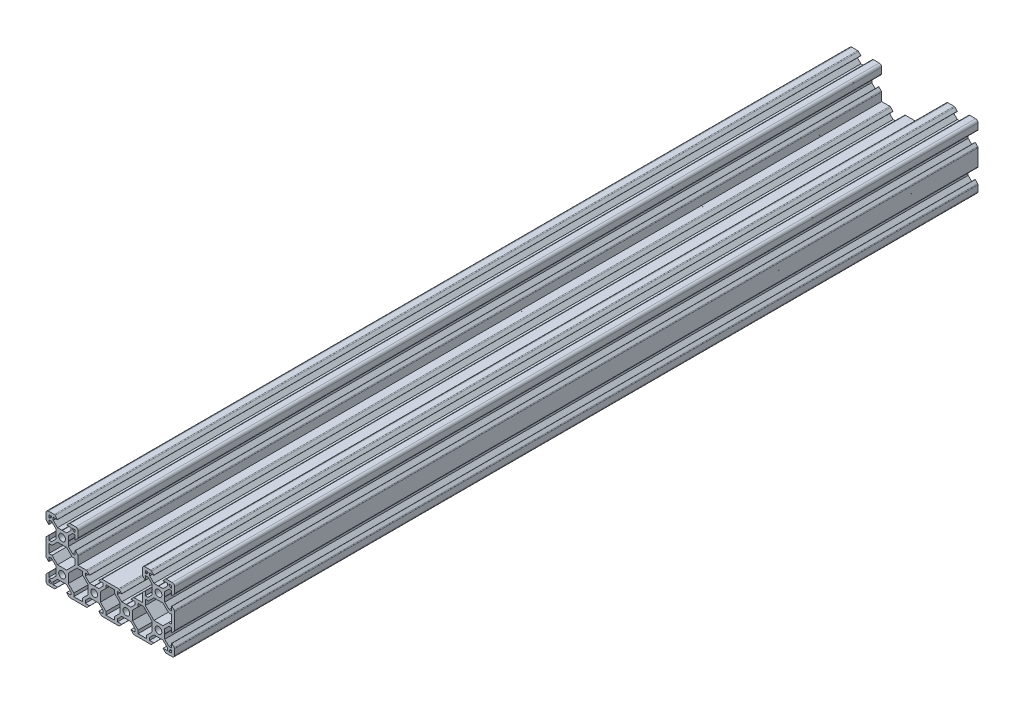
from build123d import *

# Parameters (mm, degrees)
SKETCH3_R           = 2.1
BOSS_EXTRUDE3_DEPTH = 500


with BuildPart() as part:
    # Sketch3 → Boss-Extrude3 (new body)
    with BuildSketch(Plane.XY):
        with BuildLine():
            Line((-8.2, 2.882517024), (-8.2, 5.495853945))
            Line((-8.2, 5.495853945), (-6.56, 5.495853945))
            Line((-6.56, 5.495853945), (-3.9, 2.836663079))
            Line((-3.9, 2.836663079), (-3.9, 0.09834827))
            Line((-3.9, 0.09834827), (-3.799157405, 0.00963488))
            Line((-3.799157405, 0.00963488), (-3.9, -0.103336921))
            Line((-3.9, -0.103336921), (-3.9, -2.84165173))
            Line((-3.9, -2.84165173), (-6.56, -5.496196366))
            Line((-6.56, -5.496196366), (-8.2, -5.496196366))
            Line((-8.2, -5.496196366), (-8.2, -2.882859445))
            Line((-8.2, -2.882859445), (-8.31, -2.882859445))
            Line((-8.31, -2.882859445), (-9.765685425, -4.33854487))
            ThreePointArc((-9.765685425, -4.33854487), (-9.939103626, -4.598083549), (-10, -4.904230295))
            Line((-10, -4.904230295), (-10, -15.093617801))
            ThreePointArc((-10, -15.093617801), (-9.939103626, -15.399764547), (-9.765685425, -15.659303226))
            Line((-9.765685425, -15.659303226), (-8.31, -17.114988651))
            Line((-8.31, -17.114988651), (-8.2, -17.114988651))
            Line((-8.2, -17.114988651), (-8.2, -14.50165173))
            Line((-8.2, -14.50165173), (-6.56, -14.50165173))
            Line((-6.56, -14.50165173), (-3.9, -17.168325571))
            Line((-3.9, -17.168325571), (-3.9, -19.906640381))
            Line((-3.9, -19.906640381), (-3.805222007, -20.001418373))
            Line((-3.805222007, -20.001418373), (-3.9, -20.096196366))
            Line((-3.9, -20.096196366), (-3.9, -22.834511176))
            Line((-3.9, -22.834511176), (-6.56, -25.493702041))
            Line((-6.56, -25.493702041), (-8.2, -25.493702041))
            Line((-8.2, -25.493702041), (-8.2, -22.88036512))
            Line((-8.2, -22.88036512), (-8.31, -22.88036512))
            Line((-8.31, -22.88036512), (-9.768614357, -24.338979477))
            ThreePointArc((-9.768614357, -24.338979477), (-9.939864831, -24.595273923), (-10, -24.897593834))
            Line((-10, -24.897593834), (-10, -28.49036512))
            ThreePointArc((-10, -28.49036512), (-9.560660172, -29.551025292), (-8.5, -29.99036512))
            Line((-8.5, -29.99036512), (-4.907228714, -29.99036512))
            ThreePointArc((-4.907228714, -29.99036512), (-4.597037815, -29.933069776), (-4.333990827, -29.758979477))
            Line((-4.333990827, -29.758979477), (-2.87537647, -28.30036512))
            Line((-2.87537647, -28.30036512), (-2.87537647, -28.19036512))
            Line((-2.87537647, -28.19036512), (-5.48871339, -28.19036512))
            Line((-5.48871339, -28.19036512), (-5.48871339, -26.551685287))
            Line((-5.48871339, -26.551685287), (-2.829078524, -23.892859445))
            Line((-2.829078524, -23.892859445), (-0.08871339, -23.892859445))
            Line((-0.08871339, -23.892859445), (0, -23.792859445))
            Line((0, -23.792859445), (0.08871339, -23.892859445))
            Line((0.08871339, -23.892859445), (2.829078524, -23.892859445))
            Line((2.829078524, -23.892859445), (5.503336921, -26.551280874))
            Line((5.503336921, -26.551280874), (5.503336921, -28.19036512))
            Line((5.503336921, -28.19036512), (2.89, -28.19036512))
            Line((2.89, -28.19036512), (2.89, -28.30036512))
            Line((2.89, -28.30036512), (4.345685425, -29.756050545))
            ThreePointArc((4.345685425, -29.756050545), (4.605224104, -29.929468746), (4.91137085, -29.99036512))
            Line((4.91137085, -29.99036512), (15.08862915, -29.99036512))
            ThreePointArc((15.08862915, -29.99036512), (15.394775896, -29.929468746), (15.654314575, -29.756050545))
            Line((15.654314575, -29.756050545), (17.11, -28.30036512))
            Line((17.11, -28.30036512), (17.11, -28.19036512))
            Line((17.11, -28.19036512), (14.496663079, -28.19036512))
            Line((14.496663079, -28.19036512), (14.496663079, -26.552454909))
            Line((14.496663079, -26.552454909), (17.170477537, -23.892859445))
            Line((17.170477537, -23.892859445), (19.910477537, -23.892859445))
            Line((19.910477537, -23.892859445), (20.010927049, -23.792944111))
            Line((20.010927049, -23.792944111), (20.110842384, -23.892859445))
            Line((20.110842384, -23.892859445), (22.849157193, -23.892859445))
            Line((22.849157193, -23.892859445), (25.51587163, -26.559573883))
            Line((25.51587163, -26.559573883), (25.48871339, -28.19036512))
            Line((25.48871339, -28.19036512), (22.87537647, -28.19036512))
            Line((22.87537647, -28.19036512), (22.87537647, -28.30036512))
            Line((22.87537647, -28.30036512), (24.331061895, -29.756050545))
            ThreePointArc((24.331061895, -29.756050545), (24.590600574, -29.929468746), (24.89674732, -29.99036512))
            Line((24.89674732, -29.99036512), (35.10325268, -29.99036512))
            ThreePointArc((35.10325268, -29.99036512), (35.409399426, -29.929468746), (35.668938105, -29.756050545))
            Line((35.668938105, -29.756050545), (37.12462353, -28.30036512))
            Line((37.12462353, -28.30036512), (37.12462353, -28.19036512))
            Line((37.12462353, -28.19036512), (34.51128661, -28.19036512))
            Line((34.51128661, -28.19036512), (34.48412837, -26.559573883))
            Line((34.48412837, -26.559573883), (37.150842807, -23.892859445))
            Line((37.150842807, -23.892859445), (39.889157616, -23.892859445))
            Line((39.889157616, -23.892859445), (39.989072951, -23.792944111))
            Line((39.989072951, -23.792944111), (40.089522463, -23.892859445))
            Line((40.089522463, -23.892859445), (42.829522463, -23.892859445))
            Line((42.829522463, -23.892859445), (45.503336921, -26.552454909))
            Line((45.503336921, -26.552454909), (45.503336921, -28.19036512))
            Line((45.503336921, -28.19036512), (42.89, -28.19036512))
            Line((42.89, -28.19036512), (42.89, -28.30036512))
            Line((42.89, -28.30036512), (44.345685425, -29.756050545))
            ThreePointArc((44.345685425, -29.756050545), (44.605224104, -29.929468746), (44.91137085, -29.99036512))
            Line((44.91137085, -29.99036512), (55.08862915, -29.99036512))
            ThreePointArc((55.08862915, -29.99036512), (55.394775896, -29.929468746), (55.654314575, -29.756050545))
            Line((55.654314575, -29.756050545), (57.11, -28.30036512))
            Line((57.11, -28.30036512), (57.11, -28.19036512))
            Line((57.11, -28.19036512), (54.496663079, -28.19036512))
            Line((54.496663079, -28.19036512), (54.496663079, -26.551280874))
            Line((54.496663079, -26.551280874), (57.170921476, -23.892859445))
            Line((57.170921476, -23.892859445), (59.91128661, -23.892859445))
            Line((59.91128661, -23.892859445), (60, -23.792859445))
            Line((60, -23.792859445), (60.08871339, -23.892859445))
            Line((60.08871339, -23.892859445), (62.829078524, -23.892859445))
            Line((62.829078524, -23.892859445), (65.48871339, -26.551685287))
            Line((65.48871339, -26.551685287), (65.48871339, -28.19036512))
            Line((65.48871339, -28.19036512), (62.87537647, -28.19036512))
            Line((62.87537647, -28.19036512), (62.87537647, -28.30036512))
            Line((62.87537647, -28.30036512), (64.333990827, -29.758979477))
            ThreePointArc((64.333990827, -29.758979477), (64.597037815, -29.933069776), (64.907228714, -29.99036512))
            Line((64.907228714, -29.99036512), (68.5, -29.99036512))
            ThreePointArc((68.5, -29.99036512), (69.560660172, -29.551025292), (70, -28.49036512))
            Line((70, -28.49036512), (70, -24.897593834))
            ThreePointArc((70, -24.897593834), (69.939864831, -24.595273923), (69.768614357, -24.338979477))
            Line((69.768614357, -24.338979477), (68.31, -22.88036512))
            Line((68.31, -22.88036512), (68.2, -22.88036512))
            Line((68.2, -22.88036512), (68.2, -25.493702041))
            Line((68.2, -25.493702041), (66.56, -25.493702041))
            Line((66.56, -25.493702041), (63.9, -22.834511176))
            Line((63.9, -22.834511176), (63.9, -20.096196366))
            Line((63.9, -20.096196366), (63.805222007, -20.001418373))
            Line((63.805222007, -20.001418373), (63.9, -19.906640381))
            Line((63.9, -19.906640381), (63.9, -17.168325571))
            Line((63.9, -17.168325571), (66.56, -14.50165173))
            Line((66.56, -14.50165173), (68.2, -14.50165173))
            Line((68.2, -14.50165173), (68.2, -17.114988651))
            Line((68.2, -17.114988651), (68.31, -17.114988651))
            Line((68.31, -17.114988651), (69.765685425, -15.659303226))
            ThreePointArc((69.765685425, -15.659303226), (69.939103626, -15.399764547), (70, -15.093617801))
            Line((70, -15.093617801), (70, -4.904230295))
            ThreePointArc((70, -4.904230295), (69.939103626, -4.598083549), (69.765685425, -4.33854487))
            Line((69.765685425, -4.33854487), (68.31, -2.882859445))
            Line((68.31, -2.882859445), (68.2, -2.882859445))
            Line((68.2, -2.882859445), (68.2, -5.496196366))
            Line((68.2, -5.496196366), (66.56, -5.496196366))
            Line((66.56, -5.496196366), (63.9, -2.84165173))
            Line((63.9, -2.84165173), (63.9, -0.103336921))
            Line((63.9, -0.103336921), (63.799157405, 0.00963488))
            Line((63.799157405, 0.00963488), (63.9, 0.09834827))
            Line((63.9, 0.09834827), (63.9, 2.836663079))
            Line((63.9, 2.836663079), (66.56, 5.495853945))
            Line((66.56, 5.495853945), (68.2, 5.495853945))
            Line((68.2, 5.495853945), (68.2, 2.882517024))
            Line((68.2, 2.882517024), (68.31, 2.882517024))
            Line((68.31, 2.882517024), (69.768614357, 4.341131381))
            ThreePointArc((69.768614357, 4.341131381), (69.939864831, 4.597425827), (70, 4.899745738))
            Line((70, 4.899745738), (70, 8.505591811))
            ThreePointArc((70, 8.505591811), (69.559475984, 9.569110864), (68.495956932, 10.00963488))
            Line((68.495956932, 10.00963488), (64.899916949, 10.00963488))
            ThreePointArc((64.899916949, 10.00963488), (64.597597038, 9.949499711), (64.341302592, 9.778249237))
            Line((64.341302592, 9.778249237), (62.882688235, 8.31963488))
            Line((62.882688235, 8.31963488), (62.882688235, 8.20798315))
            Line((62.882688235, 8.20798315), (65.496025155, 8.20798315))
            Line((65.496025155, 8.20798315), (65.496025155, 6.565966397))
            Line((65.496025155, 6.565966397), (62.835002123, 3.907140555))
            Line((62.835002123, 3.907140555), (60.106673841, 3.907140555))
            Line((60.106673841, 3.907140555), (60, 3.807140555))
            Line((60, 3.807140555), (59.893326159, 3.907140555))
            Line((59.893326159, 3.907140555), (57.164997877, 3.907140555))
            Line((57.164997877, 3.907140555), (54.503974845, 6.565966397))
            Line((54.503974845, 6.565966397), (54.503974845, 8.20798315))
            Line((54.503974845, 8.20798315), (57.117311765, 8.20798315))
            Line((57.117311765, 8.20798315), (57.117311765, 8.31963488))
            Line((57.117311765, 8.31963488), (55.658697408, 9.778249237))
            ThreePointArc((55.658697408, 9.778249237), (55.402402962, 9.949499711), (55.100083051, 10.00963488))
            Line((55.100083051, 10.00963488), (51.504043068, 10.00963488))
            ThreePointArc((51.504043068, 10.00963488), (50.440524016, 9.569110864), (50, 8.505591811))
            Line((50, 8.505591811), (50, 4.899745738))
            ThreePointArc((50, 4.899745738), (50.060135169, 4.597425827), (50.231385643, 4.341131381))
            Line((50.231385643, 4.341131381), (51.69, 2.882517024))
            Line((51.69, 2.882517024), (51.8, 2.882517024))
            Line((51.8, 2.882517024), (51.8, 5.495853945))
            Line((51.8, 5.495853945), (53.44, 5.495853945))
            Line((53.44, 5.495853945), (56.1, 2.836663079))
            Line((56.1, 2.836663079), (56.1, 0.09834827))
            Line((56.1, 0.09834827), (56.200842595, 0.00963488))
            Line((56.200842595, 0.00963488), (56.1, -0.103336921))
            Line((56.1, -0.103336921), (56.1, -2.84165173))
            Line((56.1, -2.84165173), (53.44, -5.496196366))
            Line((53.44, -5.496196366), (51.8, -5.496196366))
            Line((51.8, -5.496196366), (51.8, -2.882859445))
            Line((51.8, -2.882859445), (51.69, -2.882859445))
            Line((51.69, -2.882859445), (50.234314575, -4.33854487))
            ThreePointArc((50.234314575, -4.33854487), (50.060896374, -4.598083549), (50, -4.904230295))
            Line((50, -4.904230295), (50, -9.99036512))
            Line((50, -9.99036512), (44.898067602, -9.99036512))
            ThreePointArc((44.898067602, -9.99036512), (44.591343398, -10.053565048), (44.332382177, -10.229670286))
            Line((44.332382177, -10.229670286), (42.876696752, -11.685355711))
            Line((42.876696752, -11.685355711), (42.876696752, -11.789524465))
            Line((42.876696752, -11.789524465), (45.490033672, -11.789524465))
            Line((45.490033672, -11.789524465), (45.490033672, -13.429929001))
            Line((45.490033672, -13.429929001), (42.830438209, -16.089524465))
            Line((42.830438209, -16.089524465), (40.090438209, -16.089524465))
            Line((40.090438209, -16.089524465), (39.990255786, -16.189706888))
            Line((39.990255786, -16.189706888), (39.890073362, -16.089524465))
            Line((39.890073362, -16.089524465), (37.151758553, -16.089524465))
            Line((37.151758553, -16.089524465), (34.492163089, -13.429929001))
            Line((34.492163089, -13.429929001), (34.497983423, -11.79036512))
            Line((34.497983423, -11.79036512), (37.111320344, -11.79036512))
            Line((37.111320344, -11.79036512), (37.111320344, -11.68036512))
            Line((37.111320344, -11.68036512), (35.655634919, -10.224679695))
            ThreePointArc((35.655634919, -10.224679695), (35.39609624, -10.051261494), (35.089949494, -9.99036512))
            Line((35.089949494, -9.99036512), (24.910050506, -9.99036512))
            ThreePointArc((24.910050506, -9.99036512), (24.60390376, -10.051261494), (24.344365081, -10.224679695))
            Line((24.344365081, -10.224679695), (22.888679656, -11.68036512))
            Line((22.888679656, -11.68036512), (22.888679656, -11.79036512))
            Line((22.888679656, -11.79036512), (25.502016577, -11.79036512))
            Line((25.502016577, -11.79036512), (25.507836911, -13.429929001))
            Line((25.507836911, -13.429929001), (22.848241447, -16.089524465))
            Line((22.848241447, -16.089524465), (20.109926638, -16.089524465))
            Line((20.109926638, -16.089524465), (20.009744214, -16.189706888))
            Line((20.009744214, -16.189706888), (19.909561791, -16.089524465))
            Line((19.909561791, -16.089524465), (17.169561791, -16.089524465))
            Line((17.169561791, -16.089524465), (14.509966328, -13.429929001))
            Line((14.509966328, -13.429929001), (14.509966328, -11.789524465))
            Line((14.509966328, -11.789524465), (17.123303248, -11.789524465))
            Line((17.123303248, -11.789524465), (17.123303248, -11.685355711))
            Line((17.123303248, -11.685355711), (15.667617823, -10.229670286))
            ThreePointArc((15.667617823, -10.229670286), (15.408656602, -10.053565048), (15.101932398, -9.99036512))
            Line((15.101932398, -9.99036512), (10, -9.99036512))
            Line((10, -9.99036512), (10, -4.904230295))
            ThreePointArc((10, -4.904230295), (9.939103626, -4.598083549), (9.765685425, -4.33854487))
            Line((9.765685425, -4.33854487), (8.31, -2.882859445))
            Line((8.31, -2.882859445), (8.2, -2.882859445))
            Line((8.2, -2.882859445), (8.2, -5.496196366))
            Line((8.2, -5.496196366), (6.56, -5.496196366))
            Line((6.56, -5.496196366), (3.9, -2.84165173))
            Line((3.9, -2.84165173), (3.9, -0.103336921))
            Line((3.9, -0.103336921), (3.799157405, 0.00963488))
            Line((3.799157405, 0.00963488), (3.9, 0.09834827))
            Line((3.9, 0.09834827), (3.9, 2.836663079))
            Line((3.9, 2.836663079), (6.56, 5.495853945))
            Line((6.56, 5.495853945), (8.2, 5.495853945))
            Line((8.2, 5.495853945), (8.2, 2.882517024))
            Line((8.2, 2.882517024), (8.31, 2.882517024))
            Line((8.31, 2.882517024), (9.768614357, 4.341131381))
            ThreePointArc((9.768614357, 4.341131381), (9.939864831, 4.597425827), (10, 4.899745738))
            Line((10, 4.899745738), (10, 8.505591811))
            ThreePointArc((10, 8.505591811), (9.559475984, 9.569110864), (8.495956932, 10.00963488))
            Line((8.495956932, 10.00963488), (4.899916949, 10.00963488))
            ThreePointArc((4.899916949, 10.00963488), (4.597597038, 9.949499711), (4.341302592, 9.778249237))
            Line((4.341302592, 9.778249237), (2.882688235, 8.31963488))
            Line((2.882688235, 8.31963488), (2.882688235, 8.20798315))
            Line((2.882688235, 8.20798315), (5.496025155, 8.20798315))
            Line((5.496025155, 8.20798315), (5.496025155, 6.565966397))
            Line((5.496025155, 6.565966397), (2.835002123, 3.907140555))
            Line((2.835002123, 3.907140555), (0.106673841, 3.907140555))
            Line((0.106673841, 3.907140555), (0, 3.807140555))
            Line((0, 3.807140555), (-0.106673841, 3.907140555))
            Line((-0.106673841, 3.907140555), (-2.835002123, 3.907140555))
            Line((-2.835002123, 3.907140555), (-5.496025155, 6.565966397))
            Line((-5.496025155, 6.565966397), (-5.496025155, 8.20798315))
            Line((-5.496025155, 8.20798315), (-2.882688235, 8.20798315))
            Line((-2.882688235, 8.20798315), (-2.882688235, 8.31963488))
            Line((-2.882688235, 8.31963488), (-4.341302592, 9.778249237))
            ThreePointArc((-4.341302592, 9.778249237), (-4.597597038, 9.949499711), (-4.899916949, 10.00963488))
            Line((-4.899916949, 10.00963488), (-8.495956932, 10.00963488))
            ThreePointArc((-8.495956932, 10.00963488), (-9.559475984, 9.569110864), (-10, 8.505591811))
            Line((-10, 8.505591811), (-10, 4.899745738))
            ThreePointArc((-10, 4.899745738), (-9.939864831, 4.597425827), (-9.768614357, 4.341131381))
            Line((-9.768614357, 4.341131381), (-8.31, 2.882517024))
            Line((-8.31, 2.882517024), (-8.2, 2.882517024))
        make_face()
        with Locations((0, 0.00963488)):
            Circle(SKETCH3_R, mode=Mode.SUBTRACT)
        with Locations((0, -19.99036512)):
            Circle(SKETCH3_R, mode=Mode.SUBTRACT)
        with Locations((20, -19.99036512)):
            Circle(SKETCH3_R, mode=Mode.SUBTRACT)
        with Locations(Location((40, -19.99036512, 0), (0, 0, 180))):
            Circle(SKETCH3_R, mode=Mode.SUBTRACT)
        with Locations(Location((60, -19.99036512, 0), (0, 0, 180))):
            Circle(SKETCH3_R, mode=Mode.SUBTRACT)
        with Locations(Location((60, 0.00963488, 0), (0, 0, 180))):
            Circle(SKETCH3_R, mode=Mode.SUBTRACT)
        Polygon((-6.57, 8.20798315), (-6.57, 7.66798315), (-7.66, 6.57798315), (-8.2, 6.57798315), (-8.2, 8.20798315), align=None, mode=Mode.SUBTRACT)
        Polygon((-8.2, -7.297745508), (-6.238124911, -7.297745508), (-2.835002123, -3.901602147), (0, -3.901602147), (2.835002123, -3.901602147), (6.238124911, -7.297745508), (8.2, -7.297745508), (8.2, -10.729522525), (2.84, -16.089522525), (0, -16.089522525), (-2.840365134, -16.089522525), (-6.24, -12.689887659), (-8.2, -12.689887659), align=None, mode=Mode.SUBTRACT)
        Polygon((-6.57, -28.19036512), (-8.2, -28.19036512), (-8.2, -26.56036512), (-7.66, -26.56036512), (-6.57, -27.65036512), align=None, mode=Mode.SUBTRACT)
        Polygon((53.43, 8.20798315), (53.43, 7.66798315), (52.34, 6.57798315), (51.8, 6.57798315), (51.8, 8.20798315), align=None, mode=Mode.SUBTRACT)
        Polygon((27.319269746, -13.75036512), (23.909634866, -17.16), (23.909634866, -22.82073024), (27.319269746, -26.23036512), (27.319269746, -28.19036512), (32.680730254, -28.19036512), (32.680730254, -26.23036512), (36.090365134, -22.82073024), (36.090365134, -17.16), (32.680730254, -13.75036512), (32.680730254, -11.79036512), (27.319269746, -11.79036512), align=None, mode=Mode.SUBTRACT)
        Polygon((7.30963488, -26.243108892), (7.30963488, -28.19036512), (12.699999986, -28.19036512), (12.699999986, -26.24036512), (16.109634866, -22.83073024), (16.109634866, -17.159999986), (12.699999986, -13.750365106), (12.699999986, -11.798690691), (9.26963488, -11.798690691), (3.9, -17.168325571), (3.9, -22.834511176), align=None, mode=Mode.SUBTRACT)
        Polygon((51.8, -7.297745508), (53.761875089, -7.297745508), (57.164997877, -3.901602147), (60, -3.901602147), (62.835002123, -3.901602147), (66.238124911, -7.297745508), (68.2, -7.297745508), (68.2, -12.689887659), (66.24, -12.689887659), (62.840365134, -16.089522525), (60, -16.089522525), (57.16, -16.089522525), (51.8, -10.729522525), align=None, mode=Mode.SUBTRACT)
        Polygon((56.1, -17.168325571), (50.73036512, -11.798690691), (47.300000014, -11.798690691), (47.300000014, -13.750365106), (43.890365134, -17.159999986), (43.890365134, -22.83073024), (47.300000014, -26.24036512), (47.300000014, -28.19036512), (52.69036512, -28.19036512), (52.69036512, -26.243108892), (56.1, -22.834511176), align=None, mode=Mode.SUBTRACT)
        Polygon((66.57, -28.19036512), (66.57, -27.65036512), (67.66, -26.56036512), (68.2, -26.56036512), (68.2, -28.19036512), align=None, mode=Mode.SUBTRACT)
        Polygon((66.57, 8.20798315), (68.2, 8.20798315), (68.2, 6.57798315), (67.66, 6.57798315), (66.57, 7.66798315), align=None, mode=Mode.SUBTRACT)
        Polygon((6.57, 8.20798315), (8.2, 8.20798315), (8.2, 6.57798315), (7.66, 6.57798315), (6.57, 7.66798315), align=None, mode=Mode.SUBTRACT)
    extrude(amount=BOSS_EXTRUDE3_DEPTH)


solid = part.part
